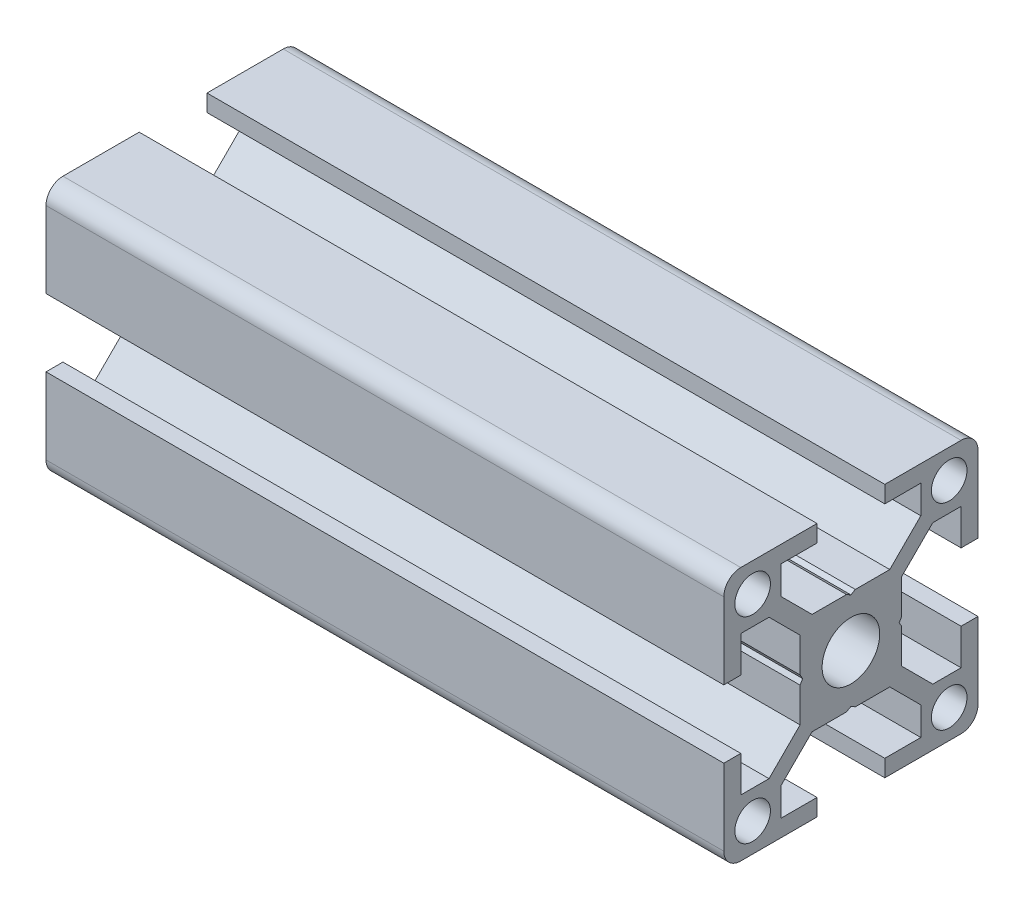
from build123d import *

# Parameters (mm, degrees)
SKETCH1_R           = 3.4
SKETCH1_R_2         = 2.1
BOSS_EXTRUDE1_DEPTH = 80


with BuildPart() as part:
    # Sketch1 → Boss-Extrude1 (new body)
    with BuildSketch(Plane(origin=(0, 0, 0), x_dir=(0, -1, 0), z_dir=(-1, 0, 0))):
        with BuildLine():
            Line((13, -4), (13, -8.25))
            Line((13, -8.25), (9.664213562, -8.25))
            Line((9.664213562, -8.25), (6, -4.585786438))
            Line((6, -4.585786438), (6, -0.519615242))
            Line((6, -0.519615242), (5.7, 0))
            Line((5.7, 0), (6, 0.519615242))
            Line((6, 0.519615242), (6, 4.585786438))
            Line((6, 4.585786438), (9.664213562, 8.25))
            Line((9.664213562, 8.25), (13, 8.25))
            Line((13, 8.25), (13, 4))
            Line((13, 4), (15, 4))
            Line((15, 4), (15, 13))
            ThreePointArc((15, 13), (14.414213562, 14.414213562), (13, 15))
            Line((13, 15), (4, 15))
            Line((4, 15), (4, 13))
            Line((4, 13), (8.25, 13))
            Line((8.25, 13), (8.25, 9.664213562))
            Line((8.25, 9.664213562), (4.585786438, 6))
            Line((4.585786438, 6), (0.519615242, 6))
            Line((0.519615242, 6), (0, 5.7))
            Line((0, 5.7), (-0.519615242, 6))
            Line((-0.519615242, 6), (-4.585786438, 6))
            Line((-4.585786438, 6), (-8.25, 9.664213562))
            Line((-8.25, 9.664213562), (-8.25, 13))
            Line((-8.25, 13), (-4, 13))
            Line((-4, 13), (-4, 15))
            Line((-4, 15), (-13, 15))
            ThreePointArc((-13, 15), (-14.414213562, 14.414213562), (-15, 13))
            Line((-15, 13), (-15, 4))
            Line((-15, 4), (-13, 4))
            Line((-13, 4), (-13, 8.25))
            Line((-13, 8.25), (-9.664213562, 8.25))
            Line((-9.664213562, 8.25), (-6, 4.585786438))
            Line((-6, 4.585786438), (-6, 0.519615242))
            Line((-6, 0.519615242), (-5.7, 0))
            Line((-5.7, 0), (-6, -0.519615242))
            Line((-6, -0.519615242), (-6, -4.585786438))
            Line((-6, -4.585786438), (-9.664213562, -8.25))
            Line((-9.664213562, -8.25), (-13, -8.25))
            Line((-13, -8.25), (-13, -4))
            Line((-13, -4), (-15, -4))
            Line((-15, -4), (-15, -13))
            ThreePointArc((-15, -13), (-14.414213562, -14.414213562), (-13, -15))
            Line((-13, -15), (-4, -15))
            Line((-4, -15), (-4, -13))
            Line((-4, -13), (-8.25, -13))
            Line((-8.25, -13), (-8.25, -9.664213562))
            Line((-8.25, -9.664213562), (-4.585786438, -6))
            Line((-4.585786438, -6), (-0.519615242, -6))
            Line((-0.519615242, -6), (0, -5.7))
            Line((0, -5.7), (0.519615242, -6))
            Line((0.519615242, -6), (4.585786438, -6))
            Line((4.585786438, -6), (8.25, -9.664213562))
            Line((8.25, -9.664213562), (8.25, -13))
            Line((8.25, -13), (4, -13))
            Line((4, -13), (4, -15))
            Line((4, -15), (13, -15))
            ThreePointArc((13, -15), (14.414213562, -14.414213562), (15, -13))
            Line((15, -13), (15, -4))
            Line((15, -4), (13, -4))
        make_face()
        with Locations(Location((0, 0, 0), (0, 0, 270))):
            Circle(SKETCH1_R, mode=Mode.SUBTRACT)
        with Locations(Location((11.6, -11.6, 0), (0, 0, 270))):
            Circle(SKETCH1_R_2, mode=Mode.SUBTRACT)
        with Locations(Location((11.6, 11.6, 0), (0, 0, 270))):
            Circle(SKETCH1_R_2, mode=Mode.SUBTRACT)
        with Locations(Location((-11.6, 11.6, 0), (0, 0, 270))):
            Circle(SKETCH1_R_2, mode=Mode.SUBTRACT)
        with Locations(Location((-11.6, -11.6, 0), (0, 0, 270))):
            Circle(SKETCH1_R_2, mode=Mode.SUBTRACT)
    extrude(amount=-BOSS_EXTRUDE1_DEPTH)


solid = part.part
